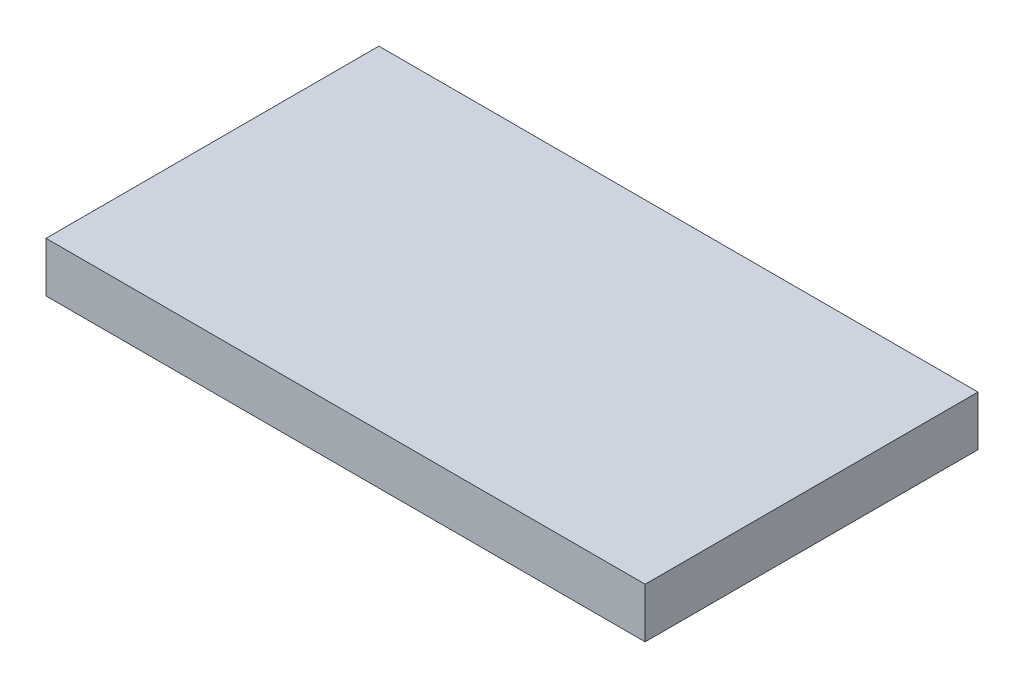
from build123d import *

# Parameters (mm, degrees)
EXTRUDE_1_DEPTH = 200


with BuildPart() as part:
    # 草图1 → 凸台-拉伸1 (new body)
    with BuildSketch(Plane.XY):
        Polygon((-349.545746258, -3.971929793), (10.454253742, -3.971929793), (10.454253742, 4.028070207), (10.454253742, 26.028070207), (-349.545746258, 26.028070207), (-349.545746258, 4.028070207), align=None)
    extrude(amount=EXTRUDE_1_DEPTH)


solid = part.part
